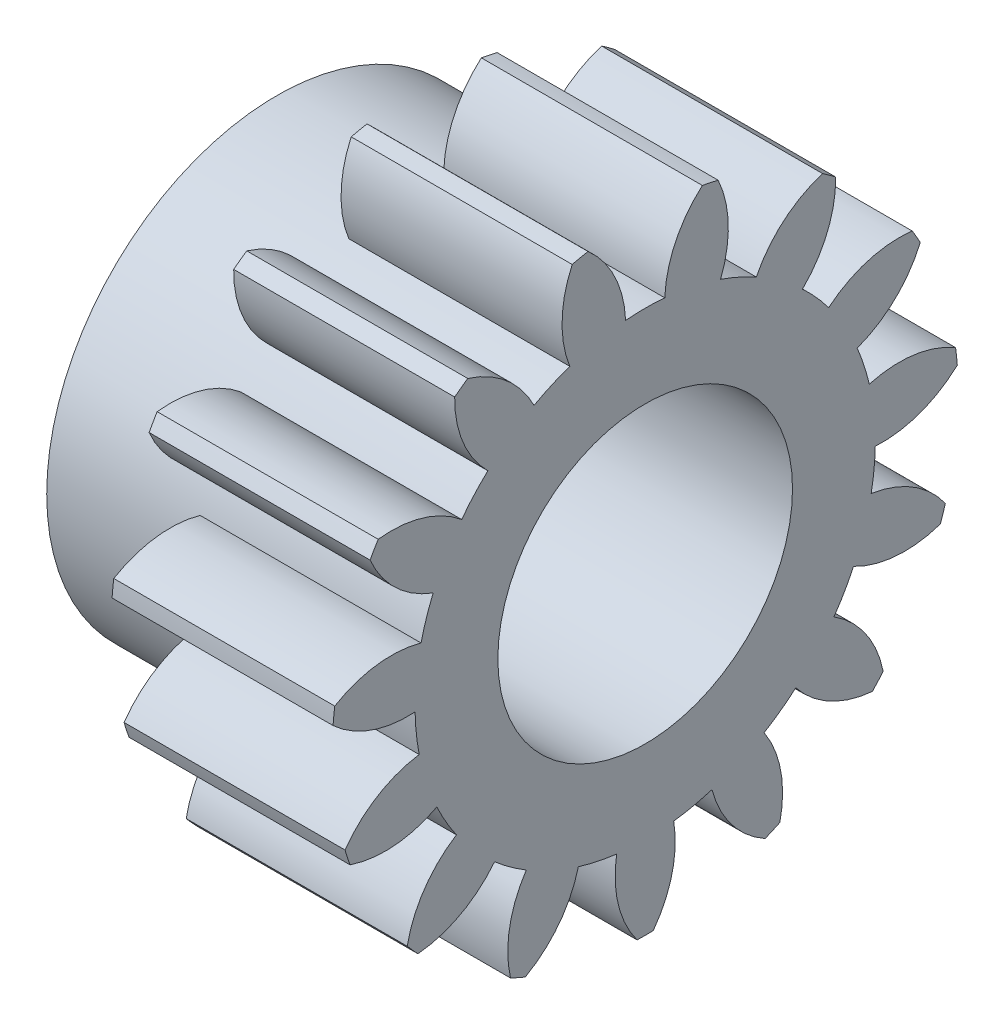
from build123d import *
from build123d.topology import SkipClean

# Parameters (mm, degrees)
BASPROSKE_W      = 3
BASPROSKE_H      = 4.25
TOOTHCUT_DEPTH   = 7.717514421
TEETHCUTS_COUNT  = 15
TEETHCUTS_ANGLE  = 336
HUBNEARONE_START = 2.0000508
HUBNEAONESKE_R   = 3.124
HUBNEARONE_DEPTH = 2.0000508
BORSKE_R         = 2
BORE_DEPTH       = 5.0000508


with BuildPart() as part:
    # BasProSke → Base-Revolve (revolve)
    with BuildSketch(Plane(origin=(0, 0, 0), x_dir=(1, 0, 0), z_dir=(0, 1, 0)), mode=Mode.PRIVATE) as base_revolve_sk:
        with Locations((1.5, 2.125)):
            Rectangle(BASPROSKE_W, BASPROSKE_H)
    revolve(base_revolve_sk.sketch.rotate(Axis((-10, 0, 0), (1, 0, 0)), 180), axis=Axis((-10, 0, 0), (1, 0, 0)))

    # TooCutSke → ToothCut (cut, through all)
    with BuildSketch(Plane(origin=(0, 0, 0), x_dir=(0, 0, -1), z_dir=(1, 0, 0))):
        with BuildLine():
            ThreePointArc((0.265767165, 3.112674704), (0, 3.124), (-0.265767165, 3.112674704))
            ThreePointArc((-0.265767165, 3.112674704), (-0.418628877, 3.712626775), (-0.800767345, 4.19974009))
            ThreePointArc((-0.800767345, 4.19974009), (0, 4.2754), (0.800767345, 4.19974009))
            ThreePointArc((0.800767345, 4.19974009), (0.418628877, 3.712626775), (0.265767165, 3.112674704))
        make_face()
    toothcut = extrude(amount=TOOTHCUT_DEPTH, mode=Mode.SUBTRACT)

    # TeethCuts: ToothCut ×15 about axis
    teethcuts_axis = Axis((-10, 0, 0), (1, 0, 0))
    for i in range(1, TEETHCUTS_COUNT):
        add(toothcut.rotate(teethcuts_axis, i * TEETHCUTS_ANGLE / (TEETHCUTS_COUNT - 1)), mode=Mode.SUBTRACT)

    # HubNeaOneSke → HubNearOne (add)
    with SkipClean():  # the faces are left unmerged after this step: merging them gives an invalid solid
        with BuildSketch(Plane.ZY.offset(HUBNEARONE_START)):
            Circle(HUBNEAONESKE_R)
        extrude(amount=-HUBNEARONE_DEPTH)

    # BorSke → Bore (cut, symmetric)
    with SkipClean():  # the faces are left unmerged after this step: merging them gives an invalid solid
        with BuildSketch(Plane(origin=(0, 0, 0), x_dir=(0, 0, -1), z_dir=(1, 0, 0))):
            with Locations(Location((0, 0, 0), (0, 0, 180))):
                Circle(BORSKE_R)
        extrude(amount=BORE_DEPTH, both=True, mode=Mode.SUBTRACT)


solid = part.part
